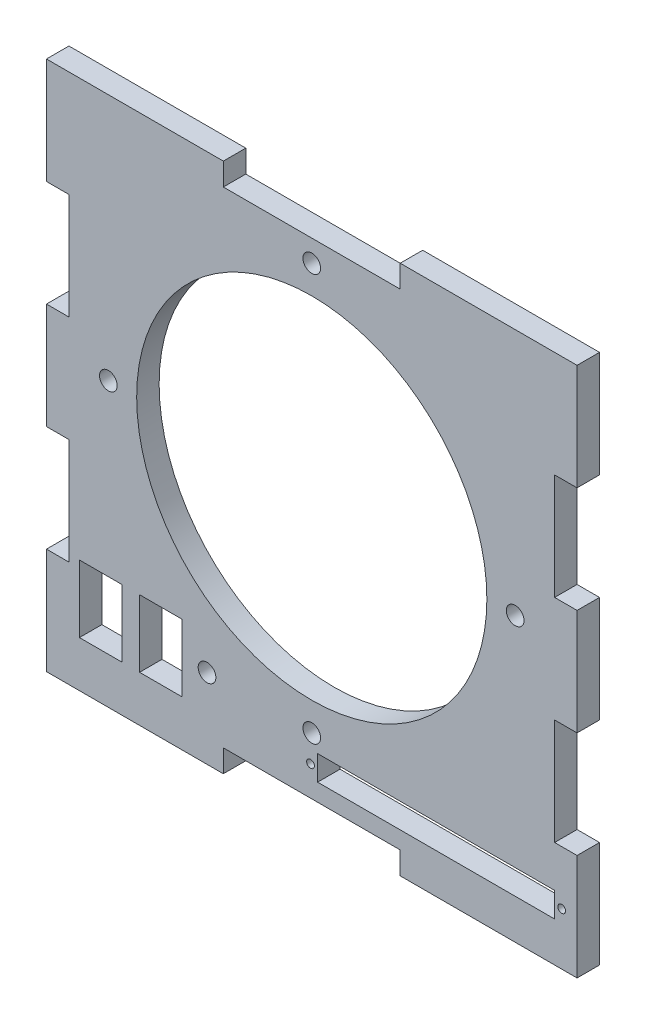
from build123d import *

# Parameters (mm, degrees)
SKETCH2_R           = 49.5
SKETCH2_R_2         = 2.5
SKETCH2_R_3         = 1.095
SKETCH2_W           = 12
SKETCH2_H           = 19
SKETCH2_W_2         = 67
SKETCH2_H_2         = 7
BOSS_EXTRUDE1_DEPTH = 6.35


with BuildPart() as part:
    # Sketch2 → Boss-Extrude1 (new body)
    with BuildSketch(Plane.XY):
        Polygon((-7.205623902, 187.891798144), (-7.205623902, 157.891798144), (-0.855623902, 157.891798144), (-0.855623902, 127.891798144), (-7.205623902, 127.891798144), (-7.205623902, 97.891798144), (-0.855623902, 97.891798144), (-0.855623902, 67.891798144), (-7.205623902, 67.891798144), (-7.205623902, 37.891798144), (42.794376098, 37.891798144), (42.794376098, 44.241798144), (92.794376098, 44.241798144), (92.794376098, 37.891798144), (142.794376098, 37.891798144), (142.794376098, 67.891798144), (136.444376098, 67.891798144), (136.444376098, 97.891798144), (142.794376098, 97.891798144), (142.794376098, 127.891798144), (136.444376098, 127.891798144), (136.444376098, 157.891798144), (142.794376098, 157.891798144), (142.794376098, 187.891798144), (92.794376098, 187.891798144), (92.794376098, 181.541798144), (42.794376098, 181.541798144), (42.794376098, 187.891798144), align=None)
        with Locations((67.794376098, 117.891798144)):
            Circle(SKETCH2_R, mode=Mode.SUBTRACT)
        with Locations((38.181618431, 60.391798144)):
            Circle(SKETCH2_R_2, mode=Mode.SUBTRACT)
        with Locations((10.294376098, 117.891798144)):
            Circle(SKETCH2_R_2, mode=Mode.SUBTRACT)
        with Locations((67.794376098, 60.391798144)):
            Circle(SKETCH2_R_2, mode=Mode.SUBTRACT)
        with Locations((125.294376098, 117.891798144)):
            Circle(SKETCH2_R_2, mode=Mode.SUBTRACT)
        with Locations((67.794376098, 175.391798144)):
            Circle(SKETCH2_R_2, mode=Mode.SUBTRACT)
        with Locations((67.444376098, 52.660955737)):
            Circle(SKETCH2_R_3, mode=Mode.SUBTRACT)
        with Locations((138.444376098, 52.660955737)):
            Circle(SKETCH2_R_3, mode=Mode.SUBTRACT)
        with Locations((25.111805458, 60.391798144)):
            Rectangle(SKETCH2_W, SKETCH2_H, mode=Mode.SUBTRACT)
        with Locations((8.111805458, 60.391798144)):
            Rectangle(SKETCH2_W, SKETCH2_H, mode=Mode.SUBTRACT)
        with Locations((102.944376098, 52.660955737)):
            Rectangle(SKETCH2_W_2, SKETCH2_H_2, mode=Mode.SUBTRACT)
    extrude(amount=BOSS_EXTRUDE1_DEPTH)


solid = part.part
